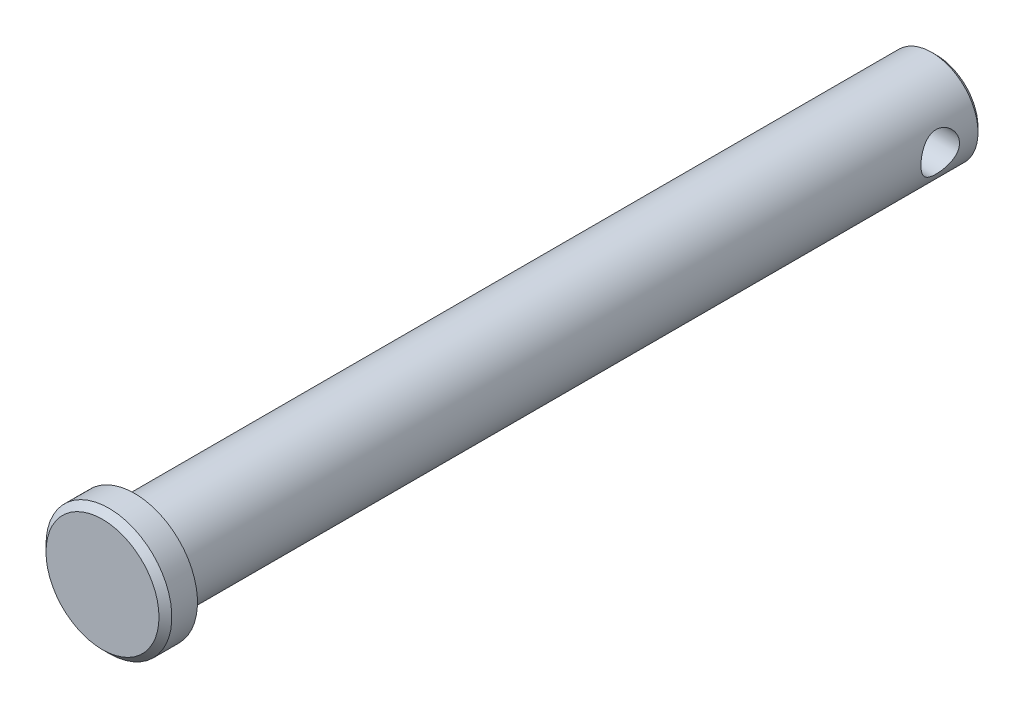
from build123d import *

# Parameters (mm, degrees)
SKETCH1_R           = 4.7625
EXTRUDE1_DEPTH      = 41.275
SKETCH2_R           = 6.477
EXTRUDE2_DEPTH      = 3.302
CHAMFER1_SIZE       = 0.6604
EXTRUDE3_DEPTH      = 46.508372713
EXTRUDE3_DEPTH_BACK = 46.508372713
SKETCH3_R           = 1.984375
CHAMFER2_SIZE       = 0.47625


with BuildPart() as part:
    # Sketch1 → Extrude1 (new, symmetric)
    with BuildSketch(Plane.XY):
        Circle(SKETCH1_R)
    extrude(amount=EXTRUDE1_DEPTH, both=True)

    # Sketch2 → Extrude2 (add)
    with BuildSketch(Plane.XY.offset(41.275)):
        with Locations(Location((0, 0, 0), (0, 0, 180))):
            Circle(SKETCH2_R)
    extrude(amount=EXTRUDE2_DEPTH)

    # Chamfer1
    chamfer1_edges = [part.edges().sort_by_distance(p)[0] for p in [
        (6.477, 0, 44.577),
    ]]
    chamfer(chamfer1_edges, length=CHAMFER1_SIZE)

    # Sketch3 → Extrude3 (cut, two sides: drawn at the far end of the back side and taken through both)
    with BuildSketch(Plane(origin=(0, 0, 0), x_dir=(0, 0, -1), z_dir=(1, 0, 0)).offset(-EXTRUDE3_DEPTH_BACK)):
        with Locations(Location((36.909375, 0, 0), (0, 0, 180.000000002))):
            Circle(SKETCH3_R)
    extrude(amount=EXTRUDE3_DEPTH + EXTRUDE3_DEPTH_BACK, mode=Mode.SUBTRACT)

    # Chamfer2
    chamfer2_edges = [part.edges().sort_by_distance(p)[0] for p in [
        (-4.7625, 0, -41.275),
    ]]
    chamfer(chamfer2_edges, length=CHAMFER2_SIZE)


solid = part.part
